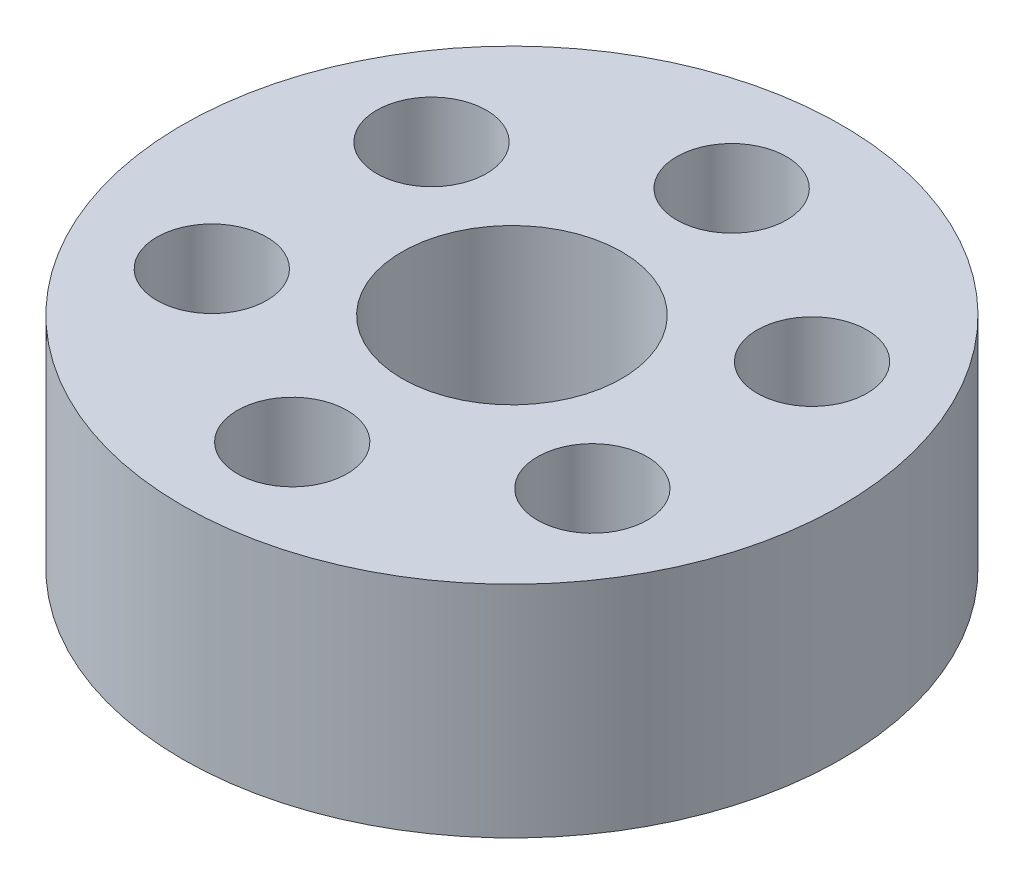
from build123d import *

# Parameters (mm, degrees)
SKETCH1_R           = 15
BOSS_EXTRUDE1_DEPTH = 10
SKETCH2_R           = 5
CUT_EXTRUDE1_DEPTH  = 24.452078799
SKETCH3_R           = 2.5
CUT_EXTRUDE2_DEPTH  = 24.452078799
CIRPATTERN1_COUNT   = 6


with BuildPart() as part:
    # Sketch1 → Boss-Extrude1 (new body)
    with BuildSketch(Plane(origin=(0, 0, 0), x_dir=(1, 0, 0), z_dir=(0, 1, 0))):
        with Locations(Location((0, 0, 0), (0, 0, 270))):
            Circle(SKETCH1_R)
    extrude(amount=BOSS_EXTRUDE1_DEPTH)

    # Sketch2 → Cut-Extrude1 (cut, through all)
    with BuildSketch(Plane(origin=(0, 10, 0), x_dir=(1, 0, 0), z_dir=(0, 1, 0))):
        with Locations(Location((0, 0, 0), (0, 0, 270))):
            Circle(SKETCH2_R)
    extrude(amount=-CUT_EXTRUDE1_DEPTH, mode=Mode.SUBTRACT)

    # Sketch3 → Cut-Extrude2 (cut, through all)
    with BuildSketch(Plane(origin=(0, 10, 0), x_dir=(1, 0, 0), z_dir=(0, 1, 0))):
        with Locations(Location((0, 10, 0), (0, 0, 270))):
            Circle(SKETCH3_R)
    cut_extrude2 = extrude(amount=-CUT_EXTRUDE2_DEPTH, mode=Mode.SUBTRACT)

    # CirPattern1: Cut-Extrude2 ×6 about axis
    cirpattern1_axis = Axis((0, 0, 0), (0, 1, 0))
    for i in range(1, CIRPATTERN1_COUNT):
        add(cut_extrude2.rotate(cirpattern1_axis, i * 360 / CIRPATTERN1_COUNT), mode=Mode.SUBTRACT)


solid = part.part
